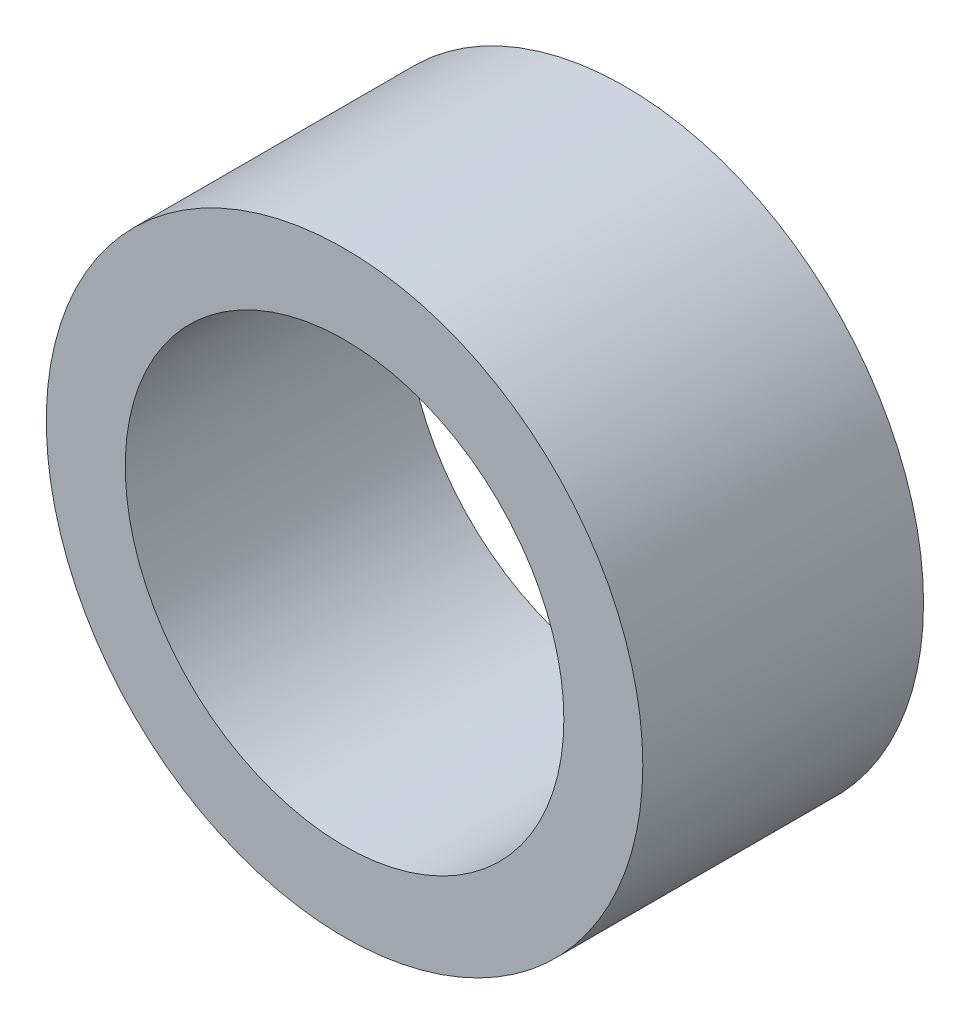
from build123d import *

# Parameters (mm, degrees)
NEEDLE_OUTER_HUB_START = 55.5
SKETCH_1_R             = 17
SKETCH_1_R_2           = 12.5
NEEDLE_OUTER_HUB_DEPTH = 16


with BuildPart() as part:
    # Эскиз1 → Needle_outer_hub (new body)
    with BuildSketch(Plane.XY.offset(NEEDLE_OUTER_HUB_START)):
        Circle(SKETCH_1_R)
        Circle(SKETCH_1_R_2, mode=Mode.SUBTRACT)
    extrude(amount=NEEDLE_OUTER_HUB_DEPTH)


solid = part.part
